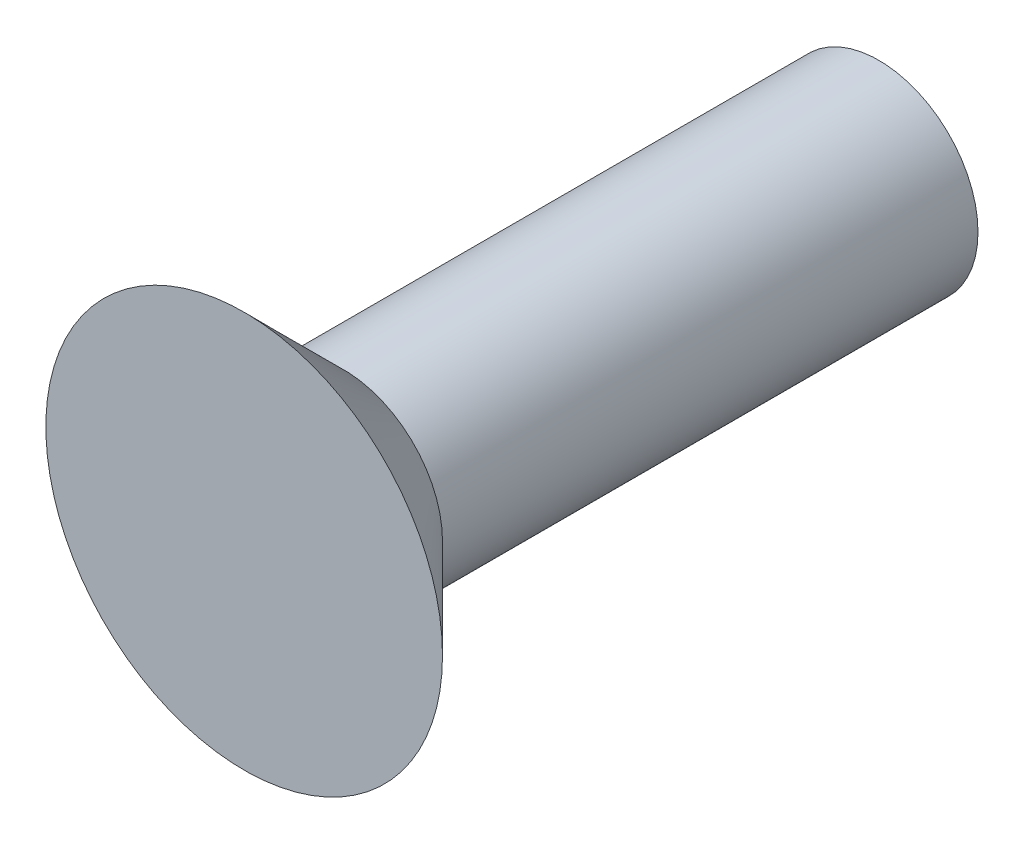
from build123d import *

# Parameters (mm, degrees)
SKETCH1_R                       = 2.5
HEAD_D5_90DEG_DEPTH             = 1.25
HEAD_D5_90DEG_DRAFT             = -45
M2P5X0P45_THREAD_ENVELOPE_START = -8
SKETCH2_R                       = 1.25
M2P5X0P45_THREAD_ENVELOPE_DEPTH = 6.75


with BuildPart() as part:
    # Sketch1 → Head_D5_90deg (with draft: the straight prism first)
    with BuildSketch(Plane.XY):
        Circle(SKETCH1_R)
    extrude(amount=-HEAD_D5_90DEG_DEPTH)
    # Head_D5_90deg: the draft: its side faces are tilted about the plane it starts from
    head_d5_90deg_sides = [part.faces().sort_by_distance(p)[0] for p in [
        (-2.5, 0, -0.625),
    ]]
    draft(head_d5_90deg_sides, Plane.XY, HEAD_D5_90DEG_DRAFT)

    # Sketch2 → M2p5x0p45_Thread_Envelope (add)
    with BuildSketch(Plane.XY.offset(M2P5X0P45_THREAD_ENVELOPE_START)):
        Circle(SKETCH2_R)
    extrude(amount=M2P5X0P45_THREAD_ENVELOPE_DEPTH)


solid = part.part
